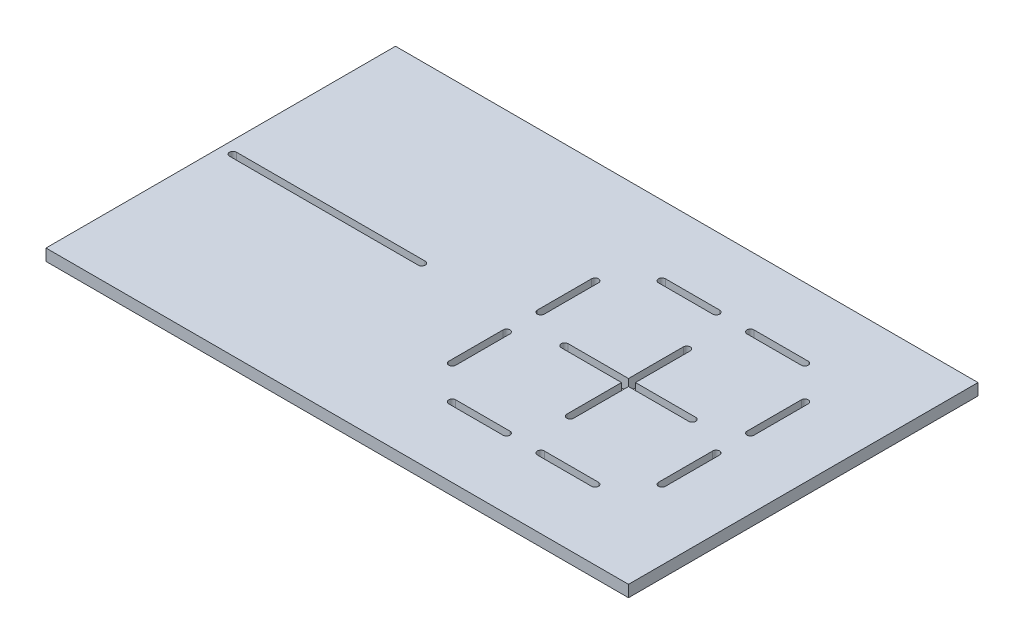
from build123d import *

# Parameters (mm, degrees)
SKETCH1_W           = 500
SKETCH1_H           = 300
BOSS_EXTRUDE1_DEPTH = 10
CUT_EXTRUDE1_DEPTH  = 10
CUT_EXTRUDE2_DEPTH  = 515.780562137
CUT_EXTRUDE3_DEPTH  = 515.780562137


with BuildPart() as part:
    # Sketch1 → Boss-Extrude1 (new body)
    with BuildSketch(Plane(origin=(0, 0, 0), x_dir=(1, 0, 0), z_dir=(0, 1, 0))):
        with Locations((195.615833125, 107.53748547)):
            Rectangle(SKETCH1_W, SKETCH1_H)
    extrude(amount=BOSS_EXTRUDE1_DEPTH)

    # Sketch2 → Cut-Extrude1 (cut)
    with BuildSketch(Plane(origin=(0, 10, 0), x_dir=(1, 0, 0), z_dir=(0, 1, 0))):
        with BuildLine():
            Line((208.615833125, 168.829709188), (208.615833125, 122.242622587))
            ThreePointArc((208.615833125, 122.242622587), (205.615833125, 119.242622587), (202.615833125, 122.242622587))
            Line((202.615833125, 122.242622587), (202.615833125, 168.829709188))
            ThreePointArc((202.615833125, 168.829709188), (205.615833125, 171.829709188), (208.615833125, 168.829709188))
        make_face()
        with BuildLine():
            Line((208.615833125, 46.245261752), (208.615833125, 92.832348352))
            ThreePointArc((208.615833125, 92.832348352), (205.615833125, 95.832348352), (202.615833125, 92.832348352))
            Line((202.615833125, 92.832348352), (202.615833125, 46.245261752))
            ThreePointArc((202.615833125, 46.245261752), (205.615833125, 43.245261752), (208.615833125, 46.245261752))
        make_face()
        with BuildLine():
            Line((356.908056843, 194.53748547), (310.320970243, 194.53748547))
            ThreePointArc((310.320970243, 194.53748547), (307.320970243, 197.53748547), (310.320970243, 200.53748547))
            Line((310.320970243, 200.53748547), (356.908056843, 200.53748547))
            ThreePointArc((356.908056843, 200.53748547), (359.908056843, 197.53748547), (356.908056843, 194.53748547))
        make_face()
        with BuildLine():
            Line((234.323609407, 194.53748547), (280.910696008, 194.53748547))
            ThreePointArc((280.910696008, 194.53748547), (283.910696008, 197.53748547), (280.910696008, 200.53748547))
            Line((280.910696008, 200.53748547), (234.323609407, 200.53748547))
            ThreePointArc((234.323609407, 200.53748547), (231.323609407, 197.53748547), (234.323609407, 194.53748547))
        make_face()
        with BuildLine():
            Line((382.615833125, 46.245261752), (382.615833125, 92.832348352))
            ThreePointArc((382.615833125, 92.832348352), (385.615833125, 95.832348352), (388.615833125, 92.832348352))
            Line((388.615833125, 92.832348352), (388.615833125, 46.245261752))
            ThreePointArc((388.615833125, 46.245261752), (385.615833125, 43.245261752), (382.615833125, 46.245261752))
        make_face()
        with BuildLine():
            Line((382.615833125, 168.829709188), (382.615833125, 122.242622587))
            ThreePointArc((382.615833125, 122.242622587), (385.615833125, 119.242622587), (388.615833125, 122.242622587))
            Line((388.615833125, 122.242622587), (388.615833125, 168.829709188))
            ThreePointArc((388.615833125, 168.829709188), (385.615833125, 171.829709188), (382.615833125, 168.829709188))
        make_face()
        with BuildLine():
            Line((234.323609407, 20.53748547), (280.910696008, 20.53748547))
            ThreePointArc((280.910696008, 20.53748547), (283.910696008, 17.53748547), (280.910696008, 14.53748547))
            Line((280.910696008, 14.53748547), (234.323609407, 14.53748547))
            ThreePointArc((234.323609407, 14.53748547), (231.323609407, 17.53748547), (234.323609407, 20.53748547))
        make_face()
        with BuildLine():
            Line((356.908056843, 20.53748547), (310.320970243, 20.53748547))
            ThreePointArc((310.320970243, 20.53748547), (307.320970243, 17.53748547), (310.320970243, 14.53748547))
            Line((310.320970243, 14.53748547), (356.908056843, 14.53748547))
            ThreePointArc((356.908056843, 14.53748547), (359.908056843, 17.53748547), (356.908056843, 20.53748547))
        make_face()
    extrude(amount=-CUT_EXTRUDE1_DEPTH, mode=Mode.SUBTRACT)

    # Sketch6 → Cut-Extrude2 (cut, through all)
    with BuildSketch(Plane(origin=(0, 10, 0), x_dir=(1, 0, 0), z_dir=(0, 1, 0))):
        with BuildLine():
            Line((-43.900749025, 110.53748547), (118.112557876, 110.53748547))
            ThreePointArc((118.112557876, 110.53748547), (121.112557876, 107.53748547), (118.112557876, 104.53748547))
            Line((118.112557876, 104.53748547), (-43.900749025, 104.53748547))
            ThreePointArc((-43.900749025, 104.53748547), (-46.900749025, 107.53748547), (-43.900749025, 110.53748547))
        make_face()
    extrude(amount=-CUT_EXTRUDE2_DEPTH, mode=Mode.SUBTRACT)

    # Sketch7 → Cut-Extrude3 (cut, through all)
    with BuildSketch(Plane(origin=(0, 10, 0), x_dir=(1, 0, 0), z_dir=(0, 1, 0))):
        with BuildLine():
            Line((292.615833125, 110.53748547), (292.615833125, 157.53748547))
            ThreePointArc((292.615833125, 157.53748547), (295.615833125, 160.53748547), (298.615833125, 157.53748547))
            Line((298.615833125, 157.53748547), (298.615833125, 110.53748547))
            Line((298.615833125, 110.53748547), (350.356251663, 110.53748547))
            ThreePointArc((350.356251663, 110.53748547), (353.356251663, 107.53748547), (350.356251663, 104.53748547))
            Line((350.356251663, 104.53748547), (298.615833125, 104.53748547))
            Line((298.615833125, 104.53748547), (298.615833125, 57.53748547))
            ThreePointArc((298.615833125, 57.53748547), (295.615833125, 54.53748547), (292.615833125, 57.53748547))
            Line((292.615833125, 57.53748547), (292.615833125, 104.53748547))
            Line((292.615833125, 104.53748547), (240.875414588, 104.53748547))
            ThreePointArc((240.875414588, 104.53748547), (237.875414588, 107.53748547), (240.875414588, 110.53748547))
            Line((240.875414588, 110.53748547), (292.615833125, 110.53748547))
        make_face()
    extrude(amount=-CUT_EXTRUDE3_DEPTH, mode=Mode.SUBTRACT)


solid = part.part
